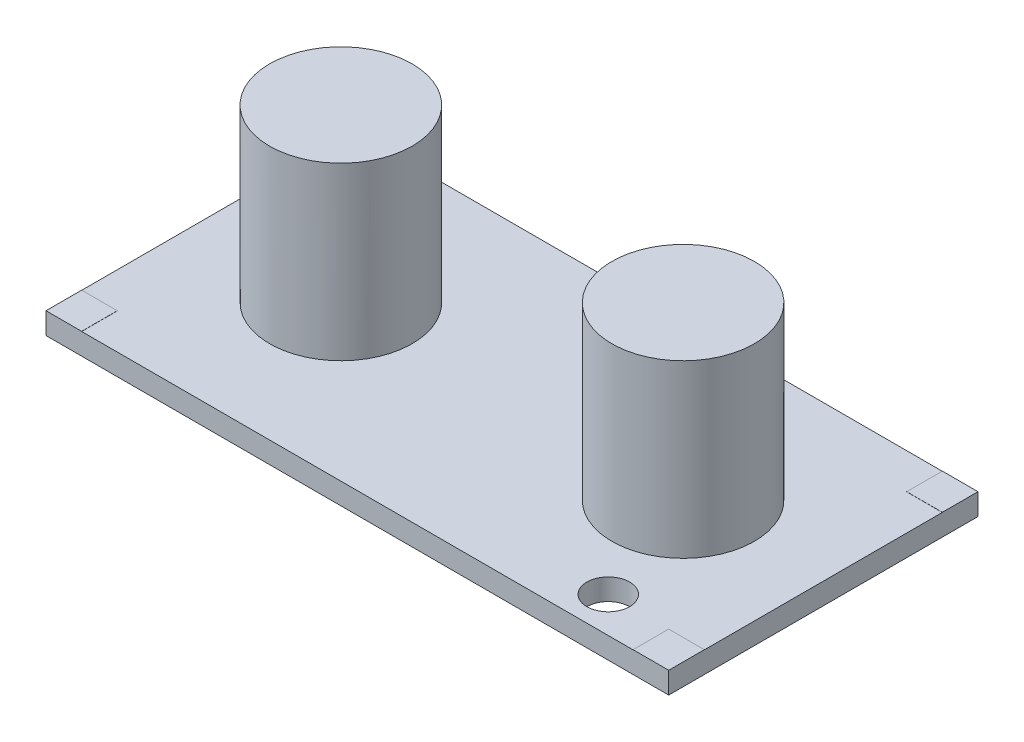
from build123d import *

# Parameters (mm, degrees)
SKETCH1_W           = 43.67
SKETCH1_H           = 21.69
SKETCH1_R           = 1.5
BOSS_EXTRUDE1_DEPTH = 1.5
SKETCH2_W           = 2.5
SKETCH2_H           = 2.5
BOSS_EXTRUDE2_DEPTH = 0.01
SKETCH3_W           = 2.5
SKETCH3_H           = 2.5
BOSS_EXTRUDE3_DEPTH = 0.01
SKETCH4_R           = 5
BOSS_EXTRUDE4_DEPTH = 12


with BuildPart() as part:
    # Sketch1 → Boss-Extrude1 (new body)
    with BuildSketch(Plane(origin=(0, 0, 0), x_dir=(1, 0, 0), z_dir=(0, 1, 0))):
        Rectangle(SKETCH1_W, SKETCH1_H)
        with Locations(Location((-15.145, 8.035, 0), (0, 0, 270))):
            Circle(SKETCH1_R, mode=Mode.SUBTRACT)
        with Locations(Location((15.095, -8.345, 0), (0, 0, 270))):
            Circle(SKETCH1_R, mode=Mode.SUBTRACT)
    extrude(amount=BOSS_EXTRUDE1_DEPTH)

    # Sketch2 → Boss-Extrude2 (add)
    with BuildSketch(Plane(origin=(0, 1.5, 0), x_dir=(1, 0, 0), z_dir=(0, 1, 0))):
        with Locations((-20.585, 9.595)):
            Rectangle(SKETCH2_W, SKETCH2_H)
        with Locations((-20.585, -9.595)):
            Rectangle(SKETCH2_W, SKETCH2_H)
    extrude(amount=BOSS_EXTRUDE2_DEPTH)

    # Sketch3 → Boss-Extrude3 (add)
    with BuildSketch(Plane(origin=(0, 1.5, 0), x_dir=(1, 0, 0), z_dir=(0, 1, 0))):
        with Locations((20.585, 9.595)):
            Rectangle(SKETCH3_W, SKETCH3_H)
        with Locations((20.585, -9.595)):
            Rectangle(SKETCH3_W, SKETCH3_H)
    extrude(amount=BOSS_EXTRUDE3_DEPTH)

    # Sketch4 → Boss-Extrude4 (add)
    with BuildSketch(Plane(origin=(0, 1.5, 0), x_dir=(1, 0, 0), z_dir=(0, 1, 0))):
        with Locations(Location((-12, 0, 0), (0, 0, 90))):
            Circle(SKETCH4_R)
        with Locations(Location((12, 0, 0), (0, 0, 90))):
            Circle(SKETCH4_R)
    extrude(amount=BOSS_EXTRUDE4_DEPTH)


solid = part.part
